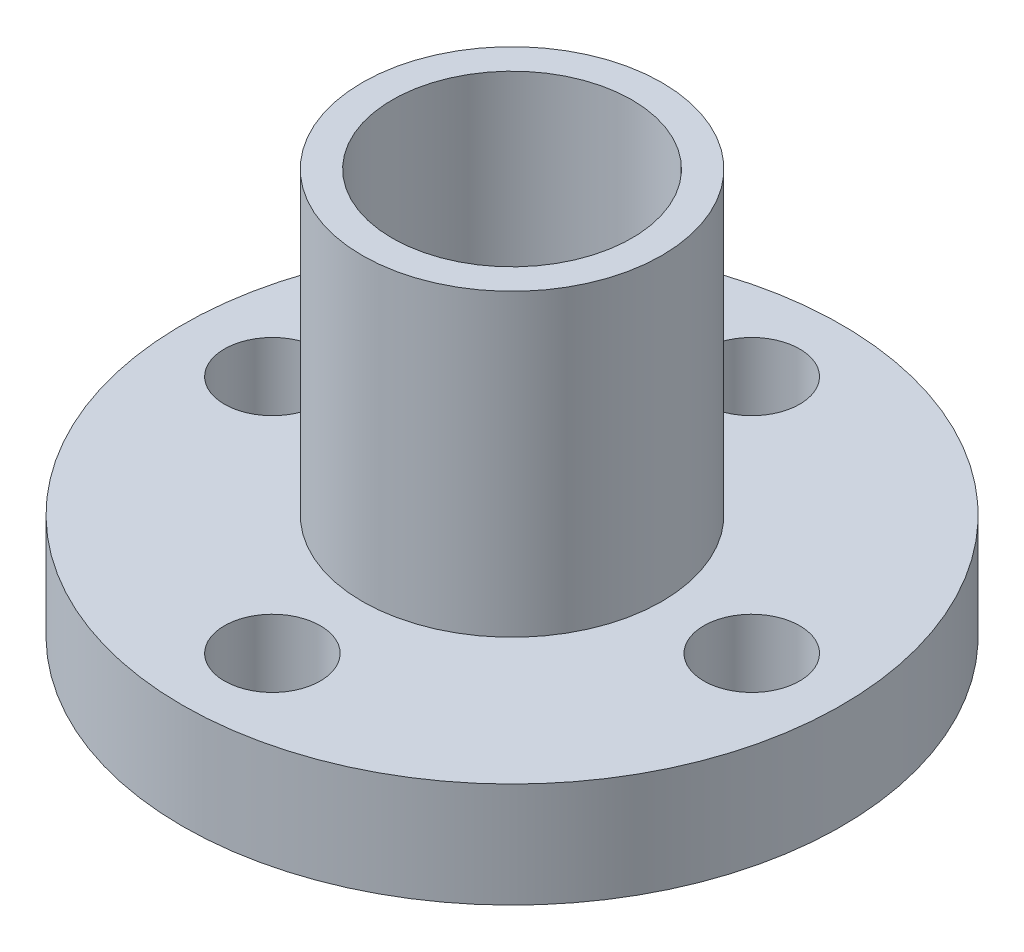
from build123d import *

# Parameters (mm, degrees)
SKETCH_1_R      = 5
SKETCH_1_R_2    = 4
EXTRUDE_1_DEPTH = 15
EXTRUDE_START   = 1.5
SKETCH_2_R      = 11
SKETCH_2_R_2    = 5
SKETCH_2_R_3    = 1.6
EXTRUDE_2_DEPTH = 3.5


with BuildPart() as part:
    # 草图1 → 凸台-拉伸1 (new body)
    with BuildSketch(Plane(origin=(0, 0, 0), x_dir=(1, 0, 0), z_dir=(0, 1, 0))):
        with Locations(Location((0, 0, 0), (0, 0, 270))):
            Circle(SKETCH_1_R)
        with Locations(Location((0, 0, 0), (0, 0, 270))):
            Circle(SKETCH_1_R_2, mode=Mode.SUBTRACT)
    extrude(amount=EXTRUDE_1_DEPTH)

    # 草图2 → 凸台-拉伸2 (add)
    with BuildSketch(Plane(origin=(0, 0, 0), x_dir=(1, 0, 0), z_dir=(0, 1, 0)).offset(EXTRUDE_START)):
        with Locations(Location((0, 0, 0), (0, 0, 270))):
            Circle(SKETCH_2_R)
        with Locations(Location((0, 0, 0), (0, 0, 270))):
            Circle(SKETCH_2_R_2, mode=Mode.SUBTRACT)
        with Locations(Location((0, 8, 0), (0, 0, 270))):
            Circle(SKETCH_2_R_3, mode=Mode.SUBTRACT)
        with Locations(Location((8, 0, 0), (0, 0, 270))):
            Circle(SKETCH_2_R_3, mode=Mode.SUBTRACT)
        with Locations(Location((0, -8, 0), (0, 0, 270))):
            Circle(SKETCH_2_R_3, mode=Mode.SUBTRACT)
        with Locations(Location((-8, 0, 0), (0, 0, 270))):
            Circle(SKETCH_2_R_3, mode=Mode.SUBTRACT)
    extrude(amount=EXTRUDE_2_DEPTH)


solid = part.part
